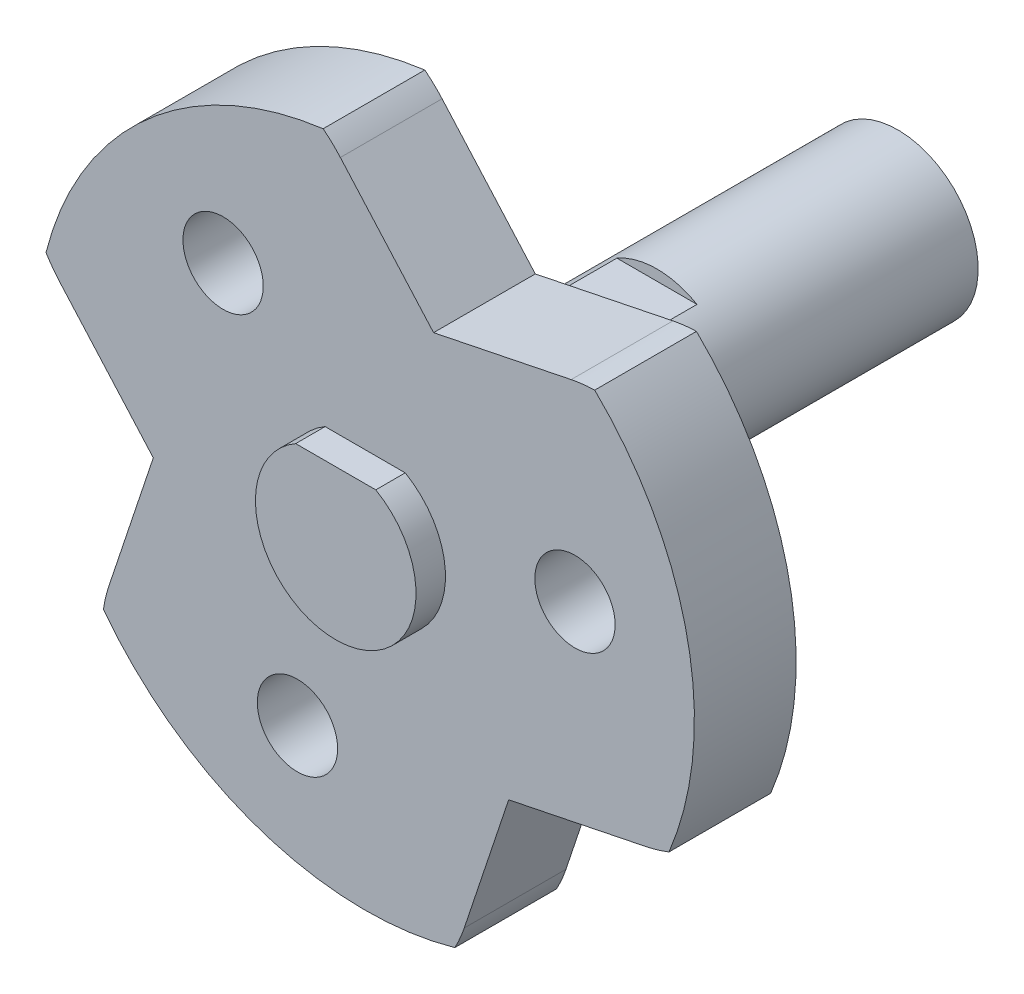
from build123d import *

# Parameters (mm, degrees)
SALIENTE_EXTRUIR1_DEPTH    = 12
SALIENTE_EXTRUIR2_START    = 9
CROQUIS2_R                 = 3
SALIENTE_EXTRUIR2_DEPTH    = 9
CROQUIS3_R                 = 5.7
SALIENTE_EXTRUIR3_DEPTH    = 8
CROQUIS4_R                 = 8.2
CROQUIS4_R_2               = 3.2
SALIENTE_EXTRUIR4_DEPTH    = 5
CORTAR_EXTRUIR1_DEPTH      = 18.420677369
CORTAR_EXTRUIR1_DEPTH_BACK = 18.420677369
CROQUIS5_R                 = 8.2
CROQUIS5_R_2               = 4.75
CROQUIS6_R                 = 14.5
CROQUIS6_R_2               = 4.75
SALIENTE_EXTRUIR5_DEPTH    = 13
CROQUIS7_R                 = 2.4
CORTAR_EXTRUIR2_DEPTH      = 25.279621084
CROQUIS8_R                 = 2.4
SALIENTE_EXTRUIR6_DEPTH    = 3.8
CROQUIS9_R                 = 14.5
CORTAR_EXTRUIR3_DEPTH      = 2.5
CROQUIS10_R                = 14.5
CORTAR_EXTRUIR4_DEPTH      = 5.6
CORTAR_EXTRUIR5_DEPTH      = 8.7
REDONDEO2_R                = 5
CORTAR_EXTRUIR6_DEPTH      = 4.9
CROQUIS14_R                = 2.4
CROQUIS14_R_2              = 1.5
CROQUIS14_R_3              = 3.2
CROQUIS14_R_4              = 2.25
SALIENTE_EXTRUIR7_DEPTH    = 3.8
CORTAR_EXTRUIR7_DEPTH      = 29.545572317
CORTAR_EXTRUIR7_DEPTH_BACK = 3.8
CROQUIS15_R                = 16.228984294
CROQUIS15_R_2              = 12.3


with BuildPart() as part:
    # Croquis1 → Saliente-Extruir1 (new body)
    with BuildSketch(Plane.XY):
        with BuildLine():
            Line((-1.496662955, 2.6), (1.496662955, 2.6))
            ThreePointArc((1.496662955, 2.6), (0, -3), (-1.496662955, 2.6))
        make_face()
    extrude(amount=SALIENTE_EXTRUIR1_DEPTH)

    # Croquis2 → Saliente-Extruir2 (add)
    with BuildSketch(Plane(origin=(0, 0, 0), x_dir=(-1, 0, 0), z_dir=(0, 0, -1)).offset(SALIENTE_EXTRUIR2_START)):
        Circle(CROQUIS2_R)
    extrude(amount=-SALIENTE_EXTRUIR2_DEPTH)


with BuildPart() as body_2:
    # Croquis3 → Saliente-Extruir3 (new body)
    with BuildSketch(Plane.XY.offset(12)):
        Circle(CROQUIS3_R)
        with BuildLine():
            Line((-1.549193338, 2.8), (1.549193338, 2.8))
            ThreePointArc((1.549193338, 2.8), (0, -3.2), (-1.549193338, 2.8))
        make_face(mode=Mode.SUBTRACT)
    extrude(amount=-SALIENTE_EXTRUIR3_DEPTH)

    # Croquis4 → Saliente-Extruir4 (add)
    with BuildSketch(Plane(origin=(0, 0, 4), x_dir=(-1, 0, 0), z_dir=(0, 0, -1))):
        Circle(CROQUIS4_R)
        with Locations(Location((0, 0, 0), (0, 0, 118.955024372))):
            Circle(CROQUIS4_R_2, mode=Mode.SUBTRACT)
    extrude(amount=SALIENTE_EXTRUIR4_DEPTH)

    # Croquis5 → Cortar-Extruir1 (cut, two sides: drawn at the far end of the back side and taken through both)
    with BuildSketch(Plane.XY.offset(4).offset(-CORTAR_EXTRUIR1_DEPTH_BACK)):
        Circle(CROQUIS5_R)
        Circle(CROQUIS5_R_2, mode=Mode.SUBTRACT)
    extrude(amount=CORTAR_EXTRUIR1_DEPTH + CORTAR_EXTRUIR1_DEPTH_BACK, mode=Mode.SUBTRACT)

    # Croquis6 → Saliente-Extruir5 (add, through all)
    with BuildSketch(Plane(origin=(0, 0, -1), x_dir=(-1, 0, 0), z_dir=(0, 0, -1))):
        Circle(CROQUIS6_R)
        Circle(CROQUIS6_R_2, mode=Mode.SUBTRACT)
    extrude(amount=-SALIENTE_EXTRUIR5_DEPTH)

    # Croquis7 → Cortar-Extruir2 (cut, through all)
    with BuildSketch(Plane(origin=(0, 0, -1), x_dir=(-1, 0, 0), z_dir=(0, 0, -1))):
        with Locations((-7.837581754, 1.603842962)):
            Circle(CROQUIS7_R)
        with Locations((5.307759626, 5.985623422)):
            Circle(CROQUIS7_R)
        with Locations((2.529822128, -7.589466384)):
            Circle(CROQUIS7_R)
    extrude(amount=-CORTAR_EXTRUIR2_DEPTH, mode=Mode.SUBTRACT)

    # Croquis8 → Saliente-Extruir6 (add)
    with BuildSketch(Plane.XY.offset(12)):
        with BuildLine():
            ThreePointArc((14.5, 0), (-3.752866127, 14.005927168), (-12.557378736, -7.24998202))
            ThreePointArc((-12.557378736, -7.24998202), (3.752866127, -14.005927168), (14.5, 0))
        make_face()
        with Locations(Location((-2.529822128, -7.589466384, 0), (0, 0, 180))):
            Circle(CROQUIS8_R, mode=Mode.SUBTRACT)
        with BuildLine():
            ThreePointArc((1.549193338, 2.8), (0, -3.2), (-1.549193338, 2.8))
            Line((-1.549193338, 2.8), (1.549193338, 2.8))
        make_face(mode=Mode.SUBTRACT)
        with Locations(Location((-5.307759626, 5.985623422, 0), (0, 0, 180))):
            Circle(CROQUIS8_R, mode=Mode.SUBTRACT)
        with Locations(Location((7.837581754, 1.603842962, 0), (0, 0, 180))):
            Circle(CROQUIS8_R, mode=Mode.SUBTRACT)
    extrude(amount=SALIENTE_EXTRUIR6_DEPTH)

    # Croquis9 → Cortar-Extruir3 (cut)
    with BuildSketch(Plane(origin=(0, 0, -1), x_dir=(-1, 0, 0), z_dir=(0, 0, -1))):
        Circle(CROQUIS9_R)
    extrude(amount=-CORTAR_EXTRUIR3_DEPTH, mode=Mode.SUBTRACT)

    # Croquis10 → Cortar-Extruir4 (cut)
    with BuildSketch(Plane(origin=(0, 0, 1.5), x_dir=(-1, 0, 0), z_dir=(0, 0, -1))):
        Circle(CROQUIS10_R)
    extrude(amount=-CORTAR_EXTRUIR4_DEPTH, mode=Mode.SUBTRACT)

    # Croquis12 → Cortar-Extruir5 (cut)
    with BuildSketch(Plane.XY.offset(15.8)):
        with BuildLine():
            ThreePointArc((-13.661331745, 4.859836927), (-14.205616929, -2.906965369), (-10.654126191, -9.835628862))
            Line((-10.654126191, -9.835628862), (-7.915513403, -1.619790499))
            Line((-7.915513403, -1.619790499), (-13.661331745, 4.859836927))
        make_face()
        with BuildLine():
            ThreePointArc((11.039408109, 9.401141877), (4.585302607, 13.755907822), (-3.190841361, 14.144558367))
            Line((-3.190841361, 14.144558367), (2.55497698, 7.664930941))
            Line((2.55497698, 7.664930941), (11.039408109, 9.401141877))
        make_face()
        with BuildLine():
            Line((5.360536423, -6.045140441), (2.621923635, -14.260978804))
            ThreePointArc((2.621923635, -14.260978804), (9.620314322, -10.848942453), (13.844967552, -4.308929505))
            Line((13.844967552, -4.308929505), (5.360536423, -6.045140441))
        make_face()
    extrude(amount=-CORTAR_EXTRUIR5_DEPTH, mode=Mode.SUBTRACT)

    # Redondeo2
    redondeo2_edges = [body_2.edges().sort_by_distance(p)[0] for p in [
        (-10.654126191, -9.835628862, 11.45),
        (-13.661331745, 4.859836927, 11.45),
        (-3.190841361, 14.144558367, 11.45),
        (11.039408109, 9.401141877, 11.45),
        (13.844967552, -4.308929505, 11.45),
        (2.621923635, -14.260978804, 11.45),
    ]]
    fillet(redondeo2_edges, radius=REDONDEO2_R)

    # Croquis13 → Cortar-Extruir6 (cut)
    with BuildSketch(Plane.XY.offset(15.8)):
        with BuildLine():
            Line((-12.145566924, 1.643263718), (-9.046770887, -1.851285291))
            Line((-9.046770887, -1.851285291), (-10.523741085, -6.282195885))
            ThreePointArc((-10.523741085, -6.282195885), (-10.451769026, -10.280553749), (-7.883204221, -13.345601943))
            ThreePointArc((-7.883204221, -13.345601943), (-4.901530373, -14.70459112), (-1.700797789, -15.406404087))
            ThreePointArc((-1.700797789, -15.406404087), (2.193082971, -14.495504415), (4.649675337, -11.340001359))
            Line((4.649675337, -11.340001359), (6.126645535, -6.909090765))
            Line((6.126645535, -6.909090765), (10.70241177, -5.97272918))
            ThreePointArc((10.70241177, -5.97272918), (14.129105224, -3.911220617), (15.499232422, -0.154254147))
            ThreePointArc((15.499232422, -0.154254147), (15.185314649, 3.107445739), (14.192736214, 6.230267952))
            ThreePointArc((14.192736214, 6.230267952), (11.456933578, 9.147017773), (7.495891587, 9.696737641))
            Line((7.495891587, 9.696737641), (2.920125352, 8.760376056))
            Line((2.920125352, 8.760376056), (-0.178670685, 12.254925065))
            ThreePointArc((-0.178670685, 12.254925065), (-3.677336199, 14.191774365), (-7.6160282, 13.49985609))
            ThreePointArc((-7.6160282, 13.49985609), (-10.283784275, 11.597145381), (-12.491938426, 9.176136135))
            ThreePointArc((-12.491938426, 9.176136135), (-13.650016549, 5.348486641), (-12.145566924, 1.643263718))
        make_face()
    extrude(amount=-CORTAR_EXTRUIR6_DEPTH, mode=Mode.SUBTRACT)

    # Croquis14 → Saliente-Extruir7 (add)
    # profile 1 of 4: a face of its own
    with BuildSketch(Plane.XY.offset(10.9)):
        with Locations((-2.529822128, -7.589466384)):
            Circle(CROQUIS14_R)
        with Locations((-2.529822128, -7.589466384)):
            Circle(CROQUIS14_R_2, mode=Mode.SUBTRACT)
    # profile 2 of 4: a face of its own
    with BuildSketch(Plane.XY.offset(10.9)):
        with Locations((7.837581754, 1.603842962)):
            Circle(CROQUIS14_R)
        with Locations((7.837581754, 1.603842962)):
            Circle(CROQUIS14_R_2, mode=Mode.SUBTRACT)
    # profile 3 of 4: a face of its own
    with BuildSketch(Plane.XY.offset(10.9)):
        Circle(CROQUIS14_R_3)
        Circle(CROQUIS14_R_4, mode=Mode.SUBTRACT)
    # profile 4 of 4: a face of its own
    with BuildSketch(Plane.XY.offset(10.9)):
        with Locations((-5.307759626, 5.985623422)):
            Circle(CROQUIS14_R)
        with Locations((-5.307759626, 5.985623422)):
            Circle(CROQUIS14_R_2, mode=Mode.SUBTRACT)
    extrude(amount=-SALIENTE_EXTRUIR7_DEPTH)

    # Croquis15 → Cortar-Extruir7 (cut, two sides: drawn at the far end of the back side and taken through both)
    with BuildSketch(Plane.XY.offset(10.9).offset(-CORTAR_EXTRUIR7_DEPTH_BACK)):
        Circle(CROQUIS15_R)
        Circle(CROQUIS15_R_2, mode=Mode.SUBTRACT)
    extrude(amount=CORTAR_EXTRUIR7_DEPTH + CORTAR_EXTRUIR7_DEPTH_BACK, mode=Mode.SUBTRACT)


solid = Compound([part.part, body_2.part])
